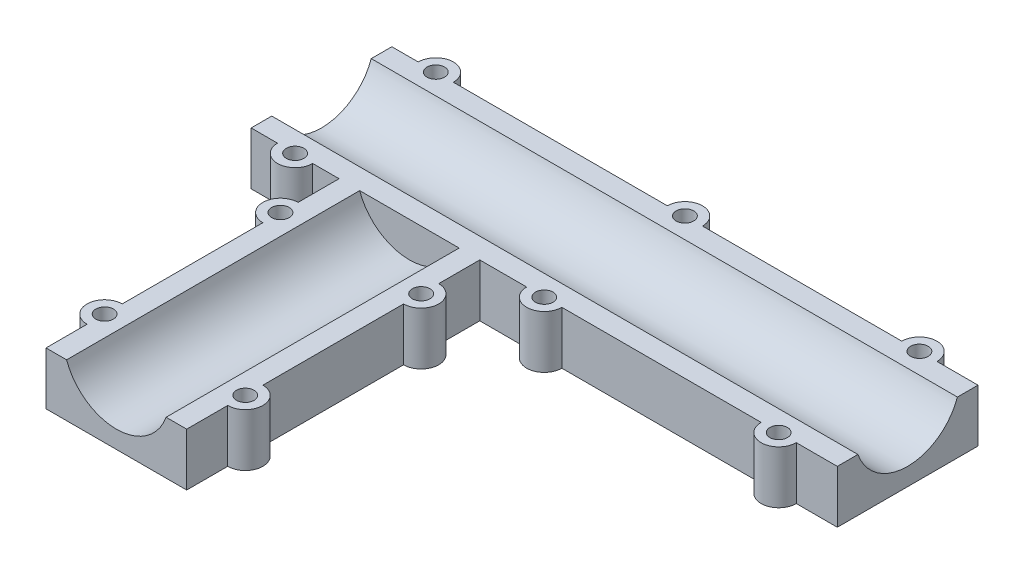
from build123d import *

# Parameters (mm, degrees)
SKETCH1_W               = 24
SKETCH1_H               = 24
BOSS_EXTRUDE1_DEPTH     = 100
SKETCH2_R               = 9
CUT_EXTRUDE1_DEPTH      = 100
SKETCH3_W               = 24
SKETCH3_H               = 24
BOSS_EXTRUDE2_DEPTH     = 50
SKETCH4_R               = 9
CUT_EXTRUDE2_DEPTH      = 50
SKETCH5_R               = 3
BOSS_EXTRUDE3_DEPTH     = 24
SKETCH6_R               = 1.5
CUT_EXTRUDE3_DEPTH      = 24
CUT_EXTRUDE4_DEPTH      = 115.350338871
CUT_EXTRUDE4_DEPTH_BACK = 115.350338871
SKETCH7_W               = 77
SKETCH7_H               = 15


with BuildPart() as part:
    # Sketch1 → Boss-Extrude1 (new body)
    with BuildSketch(Plane(origin=(0, 0, 0), x_dir=(0, 0, -1), z_dir=(1, 0, 0))):
        with Locations((12, 12)):
            Rectangle(SKETCH1_W, SKETCH1_H)
    extrude(amount=BOSS_EXTRUDE1_DEPTH)

    # Sketch2 → Cut-Extrude1 (cut)
    with BuildSketch(Plane(origin=(100, 0, 0), x_dir=(0, 0, -1), z_dir=(1, 0, 0))):
        with Locations((12, 12)):
            Circle(SKETCH2_R)
    extrude(amount=-CUT_EXTRUDE1_DEPTH, mode=Mode.SUBTRACT)

    # Sketch3 → Boss-Extrude2 (add)
    with BuildSketch(Plane.XY):
        with Locations((27, 12)):
            Rectangle(SKETCH3_W, SKETCH3_H)
    extrude(amount=BOSS_EXTRUDE2_DEPTH)

    # Sketch4 → Cut-Extrude2 (cut)
    with BuildSketch(Plane.XY.offset(50)):
        with Locations((27, 12)):
            Circle(SKETCH4_R)
    extrude(amount=-CUT_EXTRUDE2_DEPTH, mode=Mode.SUBTRACT)

    # Sketch5 → Boss-Extrude3 (add)
    with BuildSketch(Plane(origin=(0, 24, 0), x_dir=(1, 0, 0), z_dir=(0, 1, 0))):
        with Locations((90, 0)):
            Circle(SKETCH5_R)
        with Locations((90, 24)):
            Circle(SKETCH5_R)
        with Locations((50, 0)):
            Circle(SKETCH5_R)
        with Locations((50, 24)):
            Circle(SKETCH5_R)
        with Locations((7.5, 0)):
            Circle(SKETCH5_R)
        with Locations((7.5, 24)):
            Circle(SKETCH5_R)
        with Locations((15, -10)):
            Circle(SKETCH5_R)
        with Locations((39, -10)):
            Circle(SKETCH5_R)
        with Locations((15, -40)):
            Circle(SKETCH5_R)
        with Locations((39, -40)):
            Circle(SKETCH5_R)
    extrude(amount=-BOSS_EXTRUDE3_DEPTH)

    # Sketch6 → Cut-Extrude3 (cut)
    with BuildSketch(Plane(origin=(0, 24, 0), x_dir=(1, 0, 0), z_dir=(0, 1, 0))):
        with Locations(Location((50, 24, 0), (0, 0, 270))):
            Circle(SKETCH6_R)
        with Locations(Location((50, 0, 0), (0, 0, 270))):
            Circle(SKETCH6_R)
        with Locations(Location((90, 24, 0), (0, 0, 270))):
            Circle(SKETCH6_R)
        with Locations(Location((90, 0, 0), (0, 0, 270))):
            Circle(SKETCH6_R)
        with Locations(Location((15, -40, 0), (0, 0, 270))):
            Circle(SKETCH6_R)
        with Locations(Location((15, -10, 0), (0, 0, 270))):
            Circle(SKETCH6_R)
        with Locations(Location((39, -10, 0), (0, 0, 270))):
            Circle(SKETCH6_R)
        with Locations(Location((39, -40, 0), (0, 0, 270))):
            Circle(SKETCH6_R)
        with Locations(Location((7.5, 0, 0), (0, 0, 270))):
            Circle(SKETCH6_R)
        with Locations(Location((7.5, 24, 0), (0, 0, 270))):
            Circle(SKETCH6_R)
    extrude(amount=-CUT_EXTRUDE3_DEPTH, mode=Mode.SUBTRACT)

    # Sketch7 → Cut-Extrude4 (cut, two sides: drawn at the far end of the back side and taken through both)
    with BuildSketch(Plane(origin=(100, 0, 0), x_dir=(0, 0, -1), z_dir=(1, 0, 0)).offset(-CUT_EXTRUDE4_DEPTH_BACK)):
        with Locations((-11.5, 16.5)):
            Rectangle(SKETCH7_W, SKETCH7_H)
    extrude(amount=CUT_EXTRUDE4_DEPTH + CUT_EXTRUDE4_DEPTH_BACK, mode=Mode.SUBTRACT)


solid = part.part
